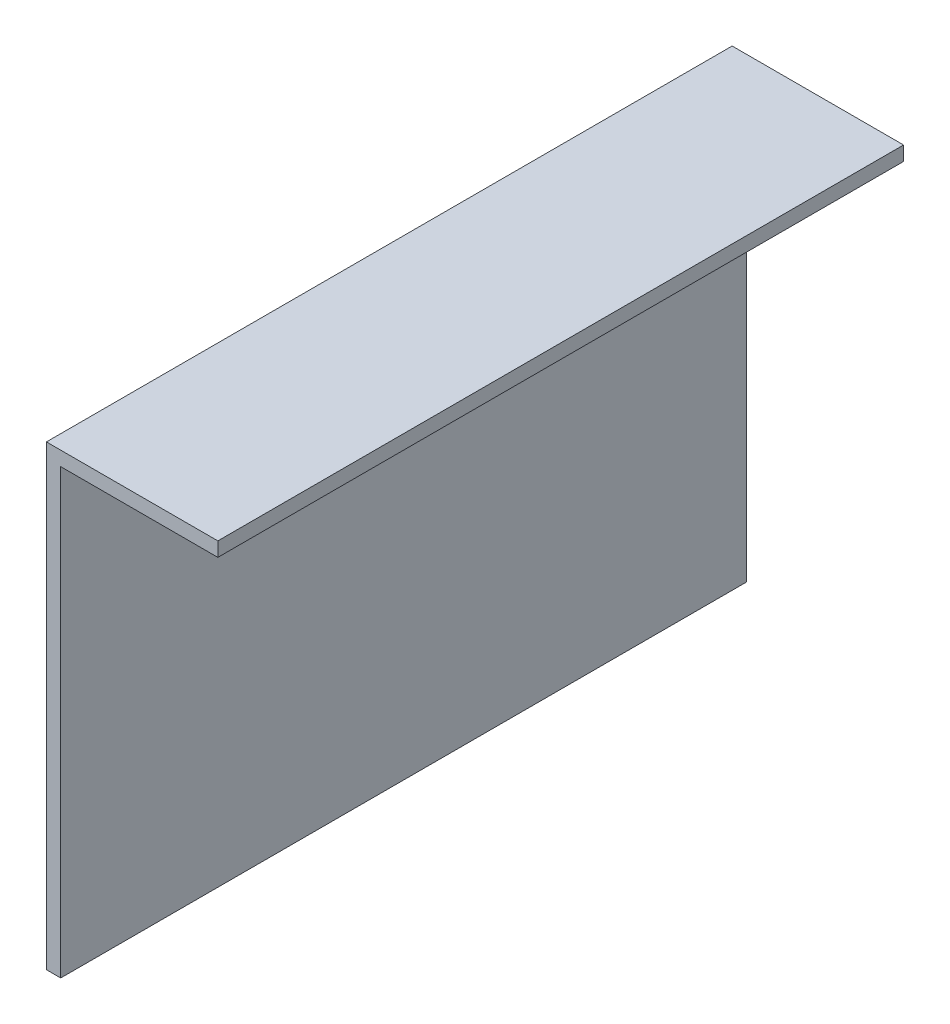
from build123d import *

# Parameters (mm, degrees)
BOSS_EXTRUDE1_DEPTH = 152.4


with BuildPart() as part:
    # Sketch1 → Boss-Extrude1 (new body)
    with BuildSketch(Plane.XY):
        Polygon((1.5875, 47.625), (36.5125, 47.625), (36.5125, 50.8), (-1.5875, 50.8), (-1.5875, -50.8), (1.5875, -50.8), align=None)
    extrude(amount=BOSS_EXTRUDE1_DEPTH)


solid = part.part
